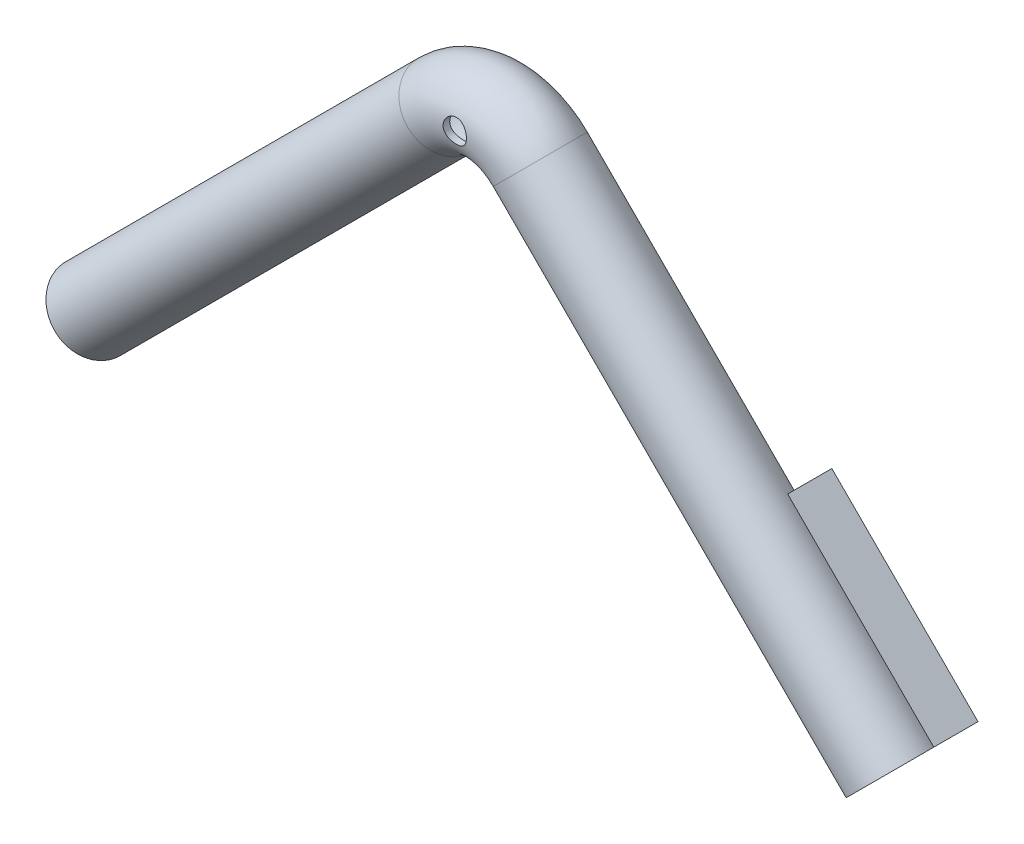
from build123d import *

# Parameters (mm, degrees)
SALIENTE_EXTRUIR1_DEPTH    = 18
SALIENTE_EXTRUIR2_DEPTH    = 18
BARRER_L_MINA1_PROFILE_R   = 11.525
BARRER_L_MINA1_PROFILE_R_2 = 9.525
CROQUIS31_R                = 3.5
CORTAR_EXTRUIR1_DEPTH      = 279.636197251


with BuildPart() as part:
    # Croquis1 → Saliente-Extruir1 (new body)
    with BuildSketch(Plane.XY):
        Polygon((0, 0), (-7.424621202, 7.424621202), (36.415999231, 51.265241636), (51.265241636, 36.415999231), (7.424621202, -7.424621202), align=None)
    extrude(amount=SALIENTE_EXTRUIR1_DEPTH)

    # Croquis2 → Saliente-Extruir2 (add)
    with BuildSketch(Plane.XY):
        Polygon((247.424621224, 7.424621202), (232.575378819, -7.424621202), (188.734758386, 36.415999231), (203.58400079, 51.265241636), align=None)
        Polygon((-7.424621202, 7.424621202), (7.424621202, -7.424621202), (51.265241636, 36.415999231), (36.415999231, 51.265241636), align=None)
    extrude(amount=SALIENTE_EXTRUIR2_DEPTH)


with BuildPart() as saliente_extruir2_piece_1:
    # of the separate pieces the step leaves, piece 1, a body of its own (saliente_extruir2_pieces)
    add(part.part.solids().sort_by_distance((-7.424621202, 7.424621202, 0))[0])



with BuildPart() as saliente_extruir2_piece_2:
    # of the separate pieces the step leaves, piece 2, a body of its own (saliente_extruir2_pieces)
    add(part.part.solids().sort_by_distance((247.424621224, 7.424621202, 0))[0])


with BuildPart() as saliente_extruir2_piece_1_1:
    add(saliente_extruir2_piece_1.part)

    add(saliente_extruir2_piece_2.part)  # Barrer-Lámina1 merges Saliente-Extruir2 piece 2
    # Barrer-Lámina1: sweep along a path in Croquis3
    with BuildLine(Plane.XY.offset(18)) as barrer_l_mina1_path:
        Line((0, 0), (105.857864387, 105.857864387))
        ThreePointArc((105.857864387, 105.857864387), (120.000000011, 111.715728763), (134.142135634, 105.857864387))
        Line((134.142135634, 105.857864387), (240.000000022, 0))
    # Barrer-Lámina1 profile (on start of the path) → Barrer-Lámina1 (sweep)
    with BuildSketch(Plane(origin=(0, 0, 18), x_dir=(0.7071067811865487, -0.7071067811865465, 0), z_dir=(0.7071067811865465, 0.7071067811865487, 0))):
        Circle(BARRER_L_MINA1_PROFILE_R)
        Circle(BARRER_L_MINA1_PROFILE_R_2, mode=Mode.SUBTRACT)
    sweep(path=barrer_l_mina1_path.line)

    # Croquis31 → Cortar-Extruir1 (cut, through all)
    with BuildSketch(Plane(origin=(0, 0, 0), x_dir=(-1, 0, 0), z_dir=(0, 0, -1))):
        with Locations(Location((-120.000000011, 111.657455894, 0), (0, 0, 312.910662072))):
            Circle(CROQUIS31_R)
    extrude(amount=-CORTAR_EXTRUIR1_DEPTH, mode=Mode.SUBTRACT)


solid = saliente_extruir2_piece_1_1.part
